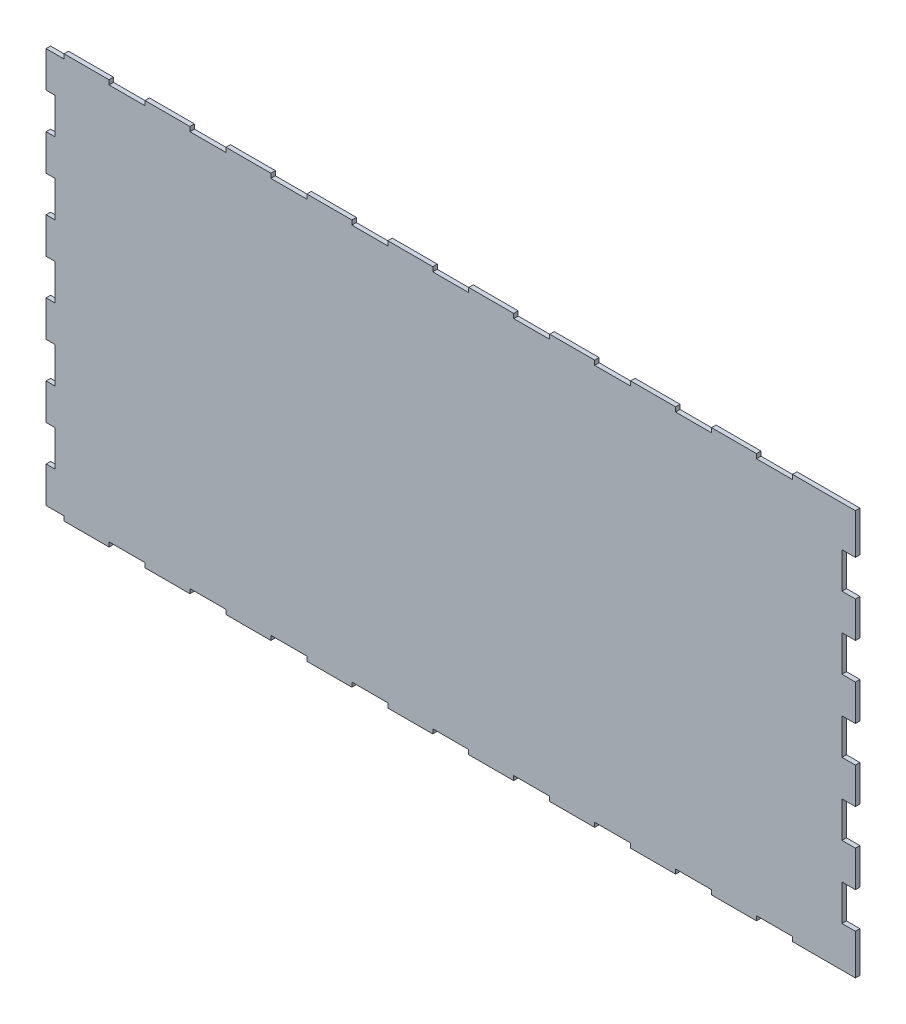
from build123d import *

# Parameters (mm, degrees)
BOSS_EXTRUDE1_DEPTH = 5


with BuildPart() as part:
    # Sketch1 → Boss-Extrude1 (new body)
    with BuildSketch(Plane.XY):
        Polygon((885, 60), (885, 100), (900, 100), (900, 140), (885, 140), (885, 180), (900, 180), (900, 225), (830, 225), (830, 220), (790, 220), (790, 225), (740, 225), (740, 220), (700, 220), (700, 225), (650, 225), (650, 220), (610, 220), (610, 225), (560, 225), (560, 220), (520, 220), (520, 225), (470, 225), (470, 220), (430, 220), (430, 225), (380, 225), (380, 220), (340, 220), (340, 225), (290, 225), (290, 220), (250, 220), (250, 225), (200, 225), (200, 220), (160, 220), (160, 225), (110, 225), (110, 220), (70, 220), (70, 225), (20, 225), (20, 220), (0, 220), (0, 180), (10, 180), (10, 140), (0, 140), (0, 100), (10, 100), (10, 60), (0, 60), (0, 20), (10, 20), (10, -20), (0, -20), (0, -60), (10, -60), (10, -100), (0, -100), (0, -140), (10, -140), (10, -180), (0, -180), (0, -220), (20, -220), (20, -225), (70, -225), (70, -220), (110, -220), (110, -225), (160, -225), (160, -220), (200, -220), (200, -225), (250, -225), (250, -220), (290, -220), (290, -225), (340, -225), (340, -220), (380, -220), (380, -225), (430, -225), (430, -220), (470, -220), (470, -225), (520, -225), (520, -220), (560, -220), (560, -225), (610, -225), (610, -220), (650, -220), (650, -225), (700, -225), (700, -220), (740, -220), (740, -225), (790, -225), (790, -220), (830, -220), (830, -225), (900, -225), (900, -180), (885, -180), (885, -140), (900, -140), (900, -100), (885, -100), (885, -60), (900, -60), (900, -20), (885, -20), (885, 20), (900, 20), (900, 60), align=None)
    extrude(amount=BOSS_EXTRUDE1_DEPTH)


solid = part.part
